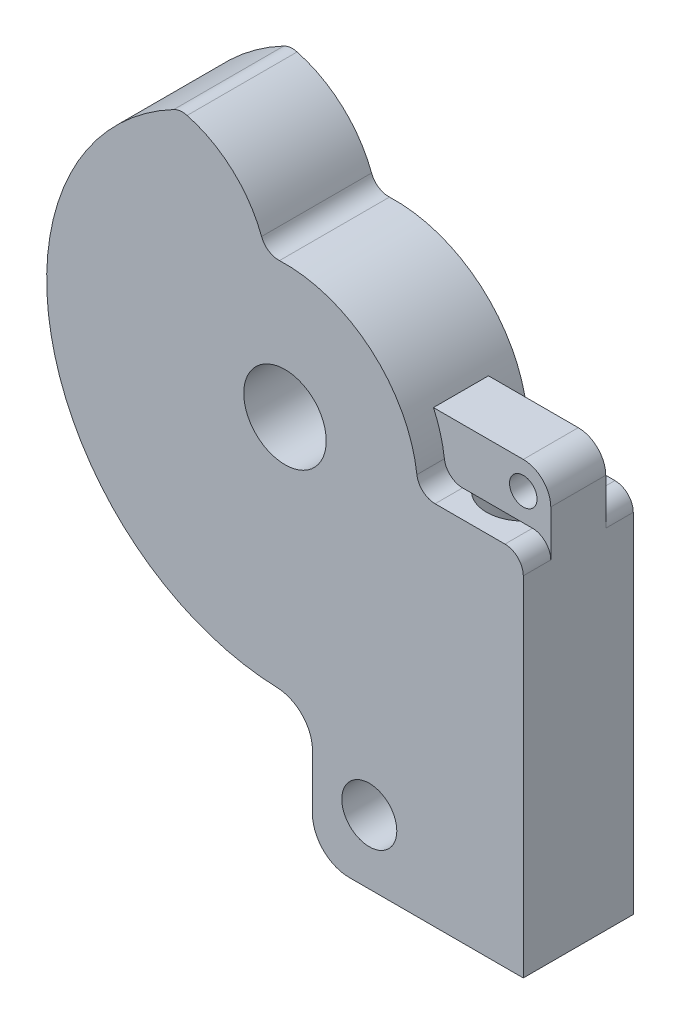
from build123d import *

# Parameters (mm, degrees)
BOSS_EXTRUDE1_DEPTH     = 3
M4_CLEARANCE_HOLE1_D    = 4.5
SKETCH5_R               = 2
CUT_EXTRUDE1_DEPTH      = 20
SKETCH8_R               = 3
CUT_EXTRUDE3_DEPTH      = 4.4
CUT_EXTRUDE4_DEPTH      = 25.596747752
BOSS_EXTRUDE2_DEPTH     = 1.5
FILLET1_R               = 1
CUT_EXTRUDE2_DEPTH      = 25.274472342
CUT_EXTRUDE2_DEPTH_BACK = 25.274472342
SKETCH7_R               = 0.75
BOSS_EXTRUDE3_START     = -6
SKETCH10_R              = 1.5
BOSS_EXTRUDE3_DEPTH     = 6
FILLET3_R               = 2


with BuildPart() as part:
    # Sketch2 → Boss-Extrude1 (new, symmetric)
    with BuildSketch(Plane.XY):
        with BuildLine():
            Line((13, 0), (13, -20))
            Line((13, -20), (7, -20))
            Line((7, -20), (7, -10.95445115))
            ThreePointArc((7, -10.95445115), (-11.401754251, 6.244997998), (13, 0))
        make_face()
    extrude(amount=BOSS_EXTRUDE1_DEPTH, both=True)

    # M4 Clearance Hole1 (through all)
    with Locations(Plane.XY.offset(3)):
        with Locations((0, 0)):
            Hole(M4_CLEARANCE_HOLE1_D / 2)

    # Sketch5 → Cut-Extrude1 (cut)
    with BuildSketch(Plane.XZ.offset(20)):
        with Locations(Location((10, 0, 0), (0, 0, 270))):
            Circle(SKETCH5_R)
    extrude(amount=-CUT_EXTRUDE1_DEPTH, mode=Mode.SUBTRACT)

    # Sketch8 → Cut-Extrude3 (cut)
    with BuildSketch(Plane.XY.offset(-3)):
        with Locations((-6.894399988, 5.785088487)):
            Circle(SKETCH8_R)
    extrude(amount=CUT_EXTRUDE3_DEPTH, mode=Mode.SUBTRACT)

    # Sketch9 → Cut-Extrude4 (cut, through all)
    with BuildSketch(Plane.XY.offset(3)):
        with BuildLine():
            Line((13, 0), (7.25, 0))
            ThreePointArc((7.25, 0), (4.738095767, 5.487526629), (-1.057020278, 7.172531501))
            ThreePointArc((-1.057020278, 7.172531501), (-2.732190546, 10.106663728), (-5.727165906, 11.670457176))
            ThreePointArc((-5.727165906, 11.670457176), (6.875567003, 11.03297686), (13, 0))
        make_face()
    extrude(amount=-CUT_EXTRUDE4_DEPTH, mode=Mode.SUBTRACT)

    # Sketch6 → Boss-Extrude2 (add, symmetric)
    with BuildSketch(Plane.XY):
        with BuildLine():
            Line((13, 1.5), (13, 0))
            Line((13, 0), (7.25, 0))
            ThreePointArc((7.25, 0), (7.085685326, 1.534784498), (6.600189391, 3))
            Line((6.600189391, 3), (11.5, 3))
            ThreePointArc((11.5, 3), (12.560660172, 2.560660172), (13, 1.5))
        make_face()
    extrude(amount=BOSS_EXTRUDE2_DEPTH, both=True)

    # Fillet1
    fillet1_edges = [part.edges().sort_by_distance(p)[0] for p in [
        (-5.727165906, 11.670457176, 0),
        (7.25, 0, -2.25),
        (-1.057020278, 7.172531501, 0),
        (7.25, 0, 2.25),
        (13, 0, -2.25),
        (13, 0, 2.25),
    ]]
    fillet(fillet1_edges, radius=FILLET1_R)

    # Sketch7 → Cut-Extrude2 (cut, two sides: drawn at the far end of the back side and taken through both)
    with BuildSketch(Plane.XY.offset(1.5).offset(-CUT_EXTRUDE2_DEPTH_BACK)):
        with Locations((11.5, 1.5)):
            Circle(SKETCH7_R)
    extrude(amount=CUT_EXTRUDE2_DEPTH + CUT_EXTRUDE2_DEPTH_BACK, mode=Mode.SUBTRACT)

    # Sketch10 → Boss-Extrude3 (add)
    with BuildSketch(Plane(origin=(0, 0, -3), x_dir=(-1, 0, 0), z_dir=(0, 0, -1)).offset(BOSS_EXTRUDE3_START)):
        with BuildLine():
            Line((-7, -10.95445115), (-7, -20))
            Line((-7, -20), (-1.5, -20))
            Line((-1.5, -20), (-1.5, -12.91317157))
            ThreePointArc((-1.5, -12.91317157), (-4.361381252, -12.246564971), (-7, -10.95445115))
        make_face()
        with Locations((-4.6, -16.5)):
            Circle(SKETCH10_R, mode=Mode.SUBTRACT)
    extrude(amount=BOSS_EXTRUDE3_DEPTH)

    # Fillet3
    fillet3_edges = [part.edges().sort_by_distance(p)[0] for p in [
        (1.5, -12.91317157, 0),
        (1.5, -20, 0),
    ]]
    fillet(fillet3_edges, radius=FILLET3_R)


solid = part.part
